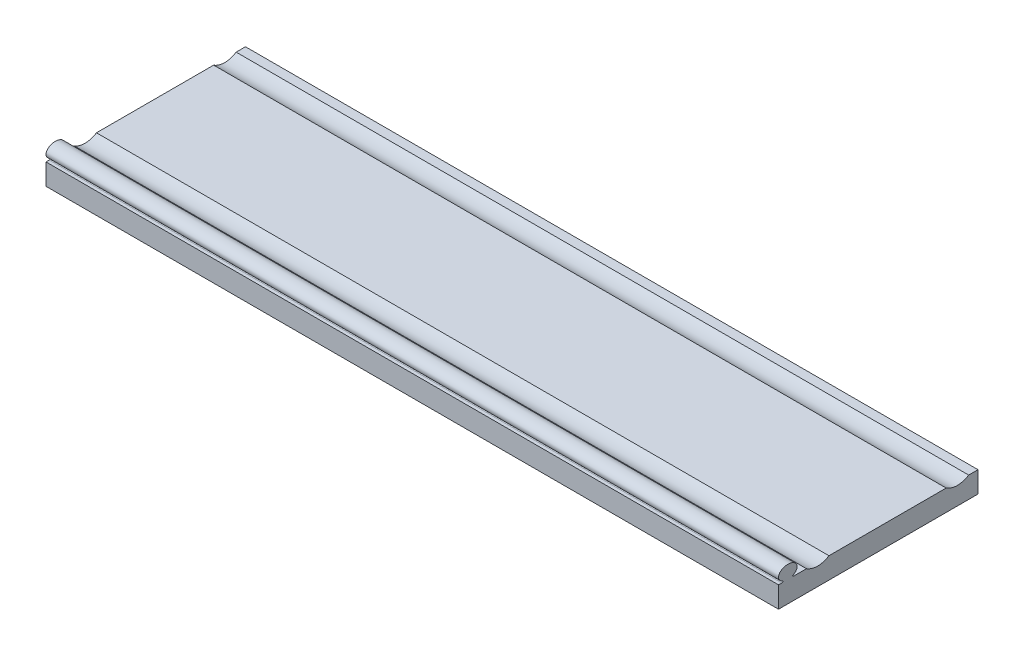
from build123d import *

# Parameters (mm, degrees)
SKETCH1_W           = 7620
SKETCH1_H           = 1219.2
BOSS_EXTRUDE1_DEPTH = 220
BOSS_EXTRUDE2_DEPTH = 7620
BOSS_EXTRUDE3_DEPTH = 7620


with BuildPart() as part:
    # Sketch1 → Boss-Extrude1 (new body)
    with BuildSketch(Plane(origin=(0, 0, 0), x_dir=(1, 0, 0), z_dir=(0, 1, 0))):
        with Locations((-3810, -609.6)):
            Rectangle(SKETCH1_W, SKETCH1_H)
    extrude(amount=BOSS_EXTRUDE1_DEPTH)

    # Sketch2 → Boss-Extrude2 (add)
    with BuildSketch(Plane(origin=(0, 0, 0), x_dir=(0, 0, -1), z_dir=(1, 0, 0))):
        with BuildLine():
            Line((-1453.26866706, 220), (-1550.370414085, 220))
            Line((-1550.370414085, 220), (-1550.370414085, 0))
            Line((-1550.370414085, 0), (-1219.2, 0))
            Line((-1219.2, 0), (-1219.2, 220))
            ThreePointArc((-1219.2, 220), (-1336.23433353, 185.188278556), (-1453.26866706, 220))
        make_face()
        with BuildLine():
            Line((0, 0), (0, 220))
            ThreePointArc((0, 220), (117.03433353, 185.188278556), (234.06866706, 220))
            Line((234.06866706, 220), (331.170414085, 220))
            Line((331.170414085, 220), (331.170414085, 0))
            Line((331.170414085, 0), (0, 0))
        make_face()
    extrude(amount=-BOSS_EXTRUDE2_DEPTH)

    # Sketch3 → Boss-Extrude3 (add)
    with BuildSketch(Plane(origin=(0, 0, 0), x_dir=(0, 0, -1), z_dir=(1, 0, 0))):
        with BuildLine():
            Line((-1550.370414085, 220), (-1583.993051919, 220))
            ThreePointArc((-1583.993051919, 220), (-1592.715486772, 222.47323034), (-1598.841549187, 229.156724736))
            add(Edge.make_bspline(
                [(-1598.841549187, 229.156724736), (-1498.831224943, 269.980639941), (-1572.996959355, 332.639247866), (-1647.162693768, 395.297855791), (-1721.32842818, 332.639247866), (-1795.494162593, 269.980639941), (-1695.483838348, 229.156724736)],
                knots=[5.235093318, 5.235093318, 5.235093318, 6.981018862, 6.981018862, 8.726944406, 8.726944406, 10.47286995, 10.47286995, 10.47286995], degree=2, weights=[1, 0.642559188, 1, 0.642559188, 1, 0.642559188, 1]))
            ThreePointArc((-1695.483838348, 229.156724736), (-1701.609900764, 222.47323034), (-1710.332335616, 220))
            Line((-1710.332335616, 220), (-1743.954973451, 220))
            Line((-1743.954973451, 220), (-1743.954973451, 0))
            Line((-1743.954973451, 0), (-1550.370414085, 0))
            Line((-1550.370414085, 0), (-1550.370414085, 220))
        make_face()
    extrude(amount=-BOSS_EXTRUDE3_DEPTH)


solid = part.part
